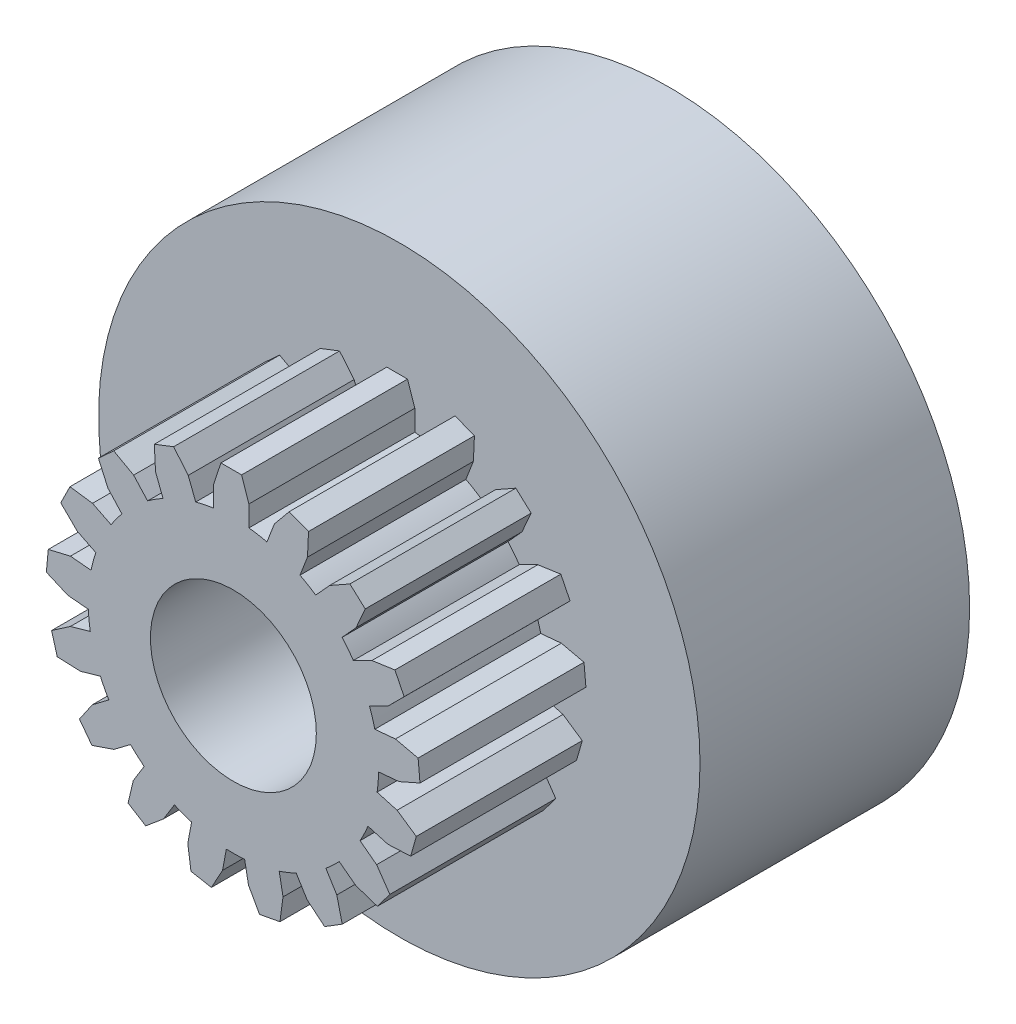
from build123d import *

# Parameters (mm, degrees)
SKETCH2_R           = 7
BOSS_EXTRUDE1_DEPTH = 8
BOSS_EXTRUDE2_DEPTH = 8
CIRPATTERN1_COUNT   = 17
SKETCH5_R           = 14.5
BOSS_EXTRUDE3_DEPTH = 13
SKETCH6_R           = 13.5
CUT_EXTRUDE1_DEPTH  = 11
SKETCH7_R           = 4
CUT_EXTRUDE2_DEPTH  = 11


with BuildPart() as part:
    # Sketch2 → Boss-Extrude1 (new body)
    with BuildSketch(Plane.XY):
        Circle(SKETCH2_R)
    extrude(amount=BOSS_EXTRUDE1_DEPTH)

    # Sketch4 → Boss-Extrude2 (add)
    with BuildSketch(Plane.XY):
        with BuildLine():
            Line((-0.95177028, 6.934993391), (-0.95177028, 7.934993391))
            Line((-0.95177028, 7.934993391), (-0.60177028, 9))
            Line((-0.60177028, 9), (0.39822972, 9))
            Line((0.39822972, 9), (0.74822972, 7.959895997))
            Line((0.74822972, 7.959895997), (0.74822972, 6.959895997))
            ThreePointArc((0.74822972, 6.959895997), (-0.102529141, 6.999249087), (-0.95177028, 6.934993391))
        make_face()
    boss_extrude2 = extrude(amount=BOSS_EXTRUDE2_DEPTH)

    # CirPattern1: Boss-Extrude2 ×17 about axis
    cirpattern1_axis = Axis((0, 0, 0), (0, 0, 1))
    for i in range(1, CIRPATTERN1_COUNT):
        add(boss_extrude2.rotate(cirpattern1_axis, i * 360 / CIRPATTERN1_COUNT))

    # Sketch5 → Boss-Extrude3 (add)
    with BuildSketch(Plane(origin=(0, 0, 0), x_dir=(-1, 0, 0), z_dir=(0, 0, -1))):
        with Locations(Location((0, 0, 0), (0, 0, 180))):
            Circle(SKETCH5_R)
    extrude(amount=BOSS_EXTRUDE3_DEPTH)

    # Sketch6 → Cut-Extrude1 (cut)
    with BuildSketch(Plane(origin=(0, 0, -13), x_dir=(-1, 0, 0), z_dir=(0, 0, -1))):
        Circle(SKETCH6_R)
    extrude(amount=-CUT_EXTRUDE1_DEPTH, mode=Mode.SUBTRACT)

    # Sketch7 → Cut-Extrude2 (cut)
    with BuildSketch(Plane.XY.offset(8)):
        Circle(SKETCH7_R)
    extrude(amount=-CUT_EXTRUDE2_DEPTH, mode=Mode.SUBTRACT)


solid = part.part
